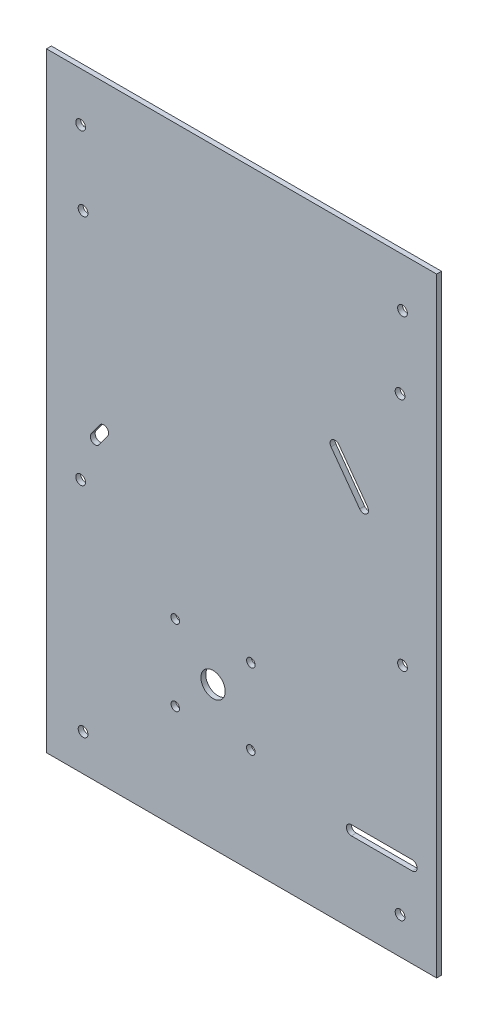
from build123d import *

# Parameters (mm, degrees)
SKETCH1_W           = 160
SKETCH1_H           = 250
BOSS_EXTRUDE1_DEPTH = 2
SKETCH2_R           = 5
SKETCH2_R_2         = 2
CUT_EXTRUDE1_DEPTH  = 149.421696527
SKETCH3_R           = 1.75
CUT_EXTRUDE2_DEPTH  = 10


with BuildPart() as part:
    # Sketch1 → Boss-Extrude1 (new body)
    with BuildSketch(Plane.XY):
        Rectangle(SKETCH1_W, SKETCH1_H)
    extrude(amount=-BOSS_EXTRUDE1_DEPTH)

    # Sketch2 → Cut-Extrude1 (cut, through all)
    with BuildSketch(Plane.XY):
        with Locations((-11.69, -66.6)):
            Circle(SKETCH2_R)
        with Locations((-66, -21)):
            Circle(SKETCH2_R_2)
        with Locations((66, -21)):
            Circle(SKETCH2_R_2)
        with Locations((-66, 105)):
            Circle(SKETCH2_R_2)
        with Locations((66, 105)):
            Circle(SKETCH2_R_2)
        with Locations((65, 75)):
            Circle(SKETCH2_R_2)
        with Locations((-65, 75)):
            Circle(SKETCH2_R_2)
        with Locations((-65, -110)):
            Circle(SKETCH2_R_2)
        with Locations((65, -110)):
            Circle(SKETCH2_R_2)
        with BuildLine():
            Line((70, -92), (45, -92))
            ThreePointArc((45, -92), (43, -90), (45, -88))
            Line((45, -88), (70, -88))
            ThreePointArc((70, -88), (72, -90), (70, -92))
        make_face()
        with BuildLine():
            Line((-54.900342972, 0.015637751), (-58.420342972, -4.843333333))
            ThreePointArc((-58.420342972, -4.843333333), (-61.213333333, -5.289657028), (-61.659657028, -2.496666667))
            Line((-61.659657028, -2.496666667), (-58.139657028, 2.362304418))
            ThreePointArc((-58.139657028, 2.362304418), (-55.346666667, 2.808628113), (-54.900342972, 0.015637751))
        make_face()
        with BuildLine():
            Line((39.928448331, 44.355), (51.678448331, 28.17051669))
            ThreePointArc((51.678448331, 28.17051669), (51.235, 25.377068359), (48.441551669, 25.82051669))
            Line((48.441551669, 25.82051669), (36.691551669, 42.005))
            ThreePointArc((36.691551669, 42.005), (37.135, 44.798448331), (39.928448331, 44.355))
        make_face()
    extrude(amount=-CUT_EXTRUDE1_DEPTH, mode=Mode.SUBTRACT)

    # Sketch3 → Cut-Extrude2 (cut)
    with BuildSketch(Plane.XY):
        with Locations((-27.19, -51.1)):
            Circle(SKETCH3_R)
        with Locations((3.81, -51.1)):
            Circle(SKETCH3_R)
        with Locations((3.81, -82.1)):
            Circle(SKETCH3_R)
        with Locations((-27.19, -82.1)):
            Circle(SKETCH3_R)
    extrude(amount=-CUT_EXTRUDE2_DEPTH, mode=Mode.SUBTRACT)


solid = part.part
